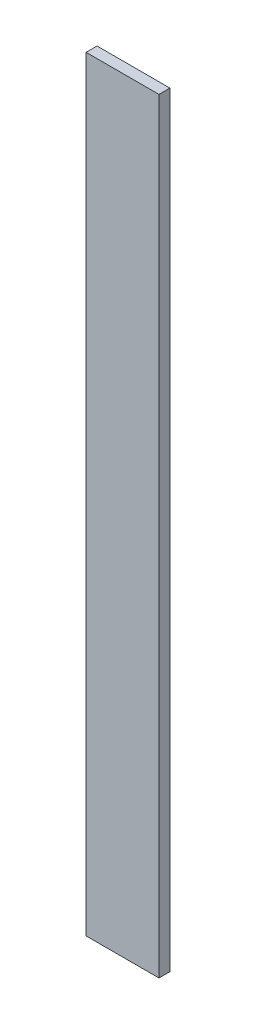
from build123d import *

# Parameters (mm, degrees)
SKETCH1_W           = 40
SKETCH1_H           = 420
BOSS_EXTRUDE1_DEPTH = 6


with BuildPart() as part:
    # Sketch1 → Boss-Extrude1 (new body)
    with BuildSketch(Plane.XY):
        Rectangle(SKETCH1_W, SKETCH1_H)
    extrude(amount=BOSS_EXTRUDE1_DEPTH)


solid = part.part
